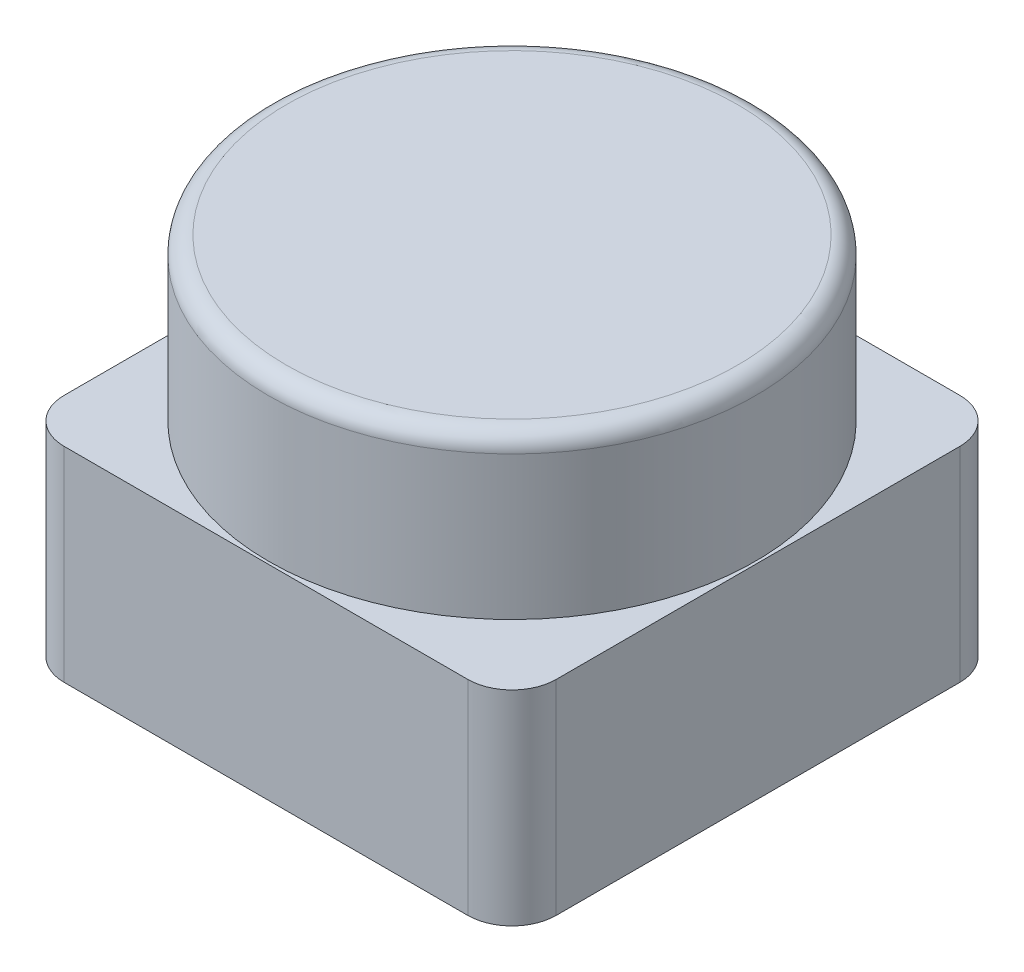
from build123d import *

# Parameters (mm, degrees)
SKETCH_2_W          = 55.6
SKETCH_2_H          = 55.6
EXTRUDE_1_DEPTH     = 23.1
SKETCH_3_R          = 27.5
EXTRUDE_2_DEPTH     = 18.2
HOLE_WIZARD_1_D     = 2.5
HOLE_WIZARD_1_DEPTH = 4
FILLET_1_R          = 5
FILLET_2_R          = 2


with BuildPart() as part:
    # 草图2 → 凸台-拉伸1 (new body)
    with BuildSketch(Plane(origin=(0, 0, 0), x_dir=(1, 0, 0), z_dir=(0, 1, 0))):
        Rectangle(SKETCH_2_W, SKETCH_2_H)
    extrude(amount=EXTRUDE_1_DEPTH)

    # 草图3 → 凸台-拉伸2 (add)
    with BuildSketch(Plane(origin=(0, 23.1, 0), x_dir=(1, 0, 0), z_dir=(0, 1, 0))):
        with Locations(Location((0, 0, 0), (0, 0, 270))):
            Circle(SKETCH_3_R)
    extrude(amount=EXTRUDE_2_DEPTH)

    # 孔1
    with Locations(Plane(origin=(0, 0, 0), x_dir=(-1, 0, 0), z_dir=(0, -1, 0))):
        with Locations((-21.5, 21.5), (21.5, 21.5), (21.5, -21.5), (-21.5, -21.5)):
            Hole(HOLE_WIZARD_1_D / 2, depth=HOLE_WIZARD_1_DEPTH)

    # 圆角1
    fillet_1_edges = [part.edges().sort_by_distance(p)[0] for p in [
        (27.8, 11.55, 27.8),
        (-27.8, 11.55, 27.8),
        (-27.8, 11.55, -27.8),
        (27.8, 11.55, -27.8),
    ]]
    fillet(fillet_1_edges, radius=FILLET_1_R)

    # 圆角2
    fillet_2_edges = [part.edges().sort_by_distance(p)[0] for p in [
        (0, 41.3, -27.5),
    ]]
    fillet(fillet_2_edges, radius=FILLET_2_R)


solid = part.part
